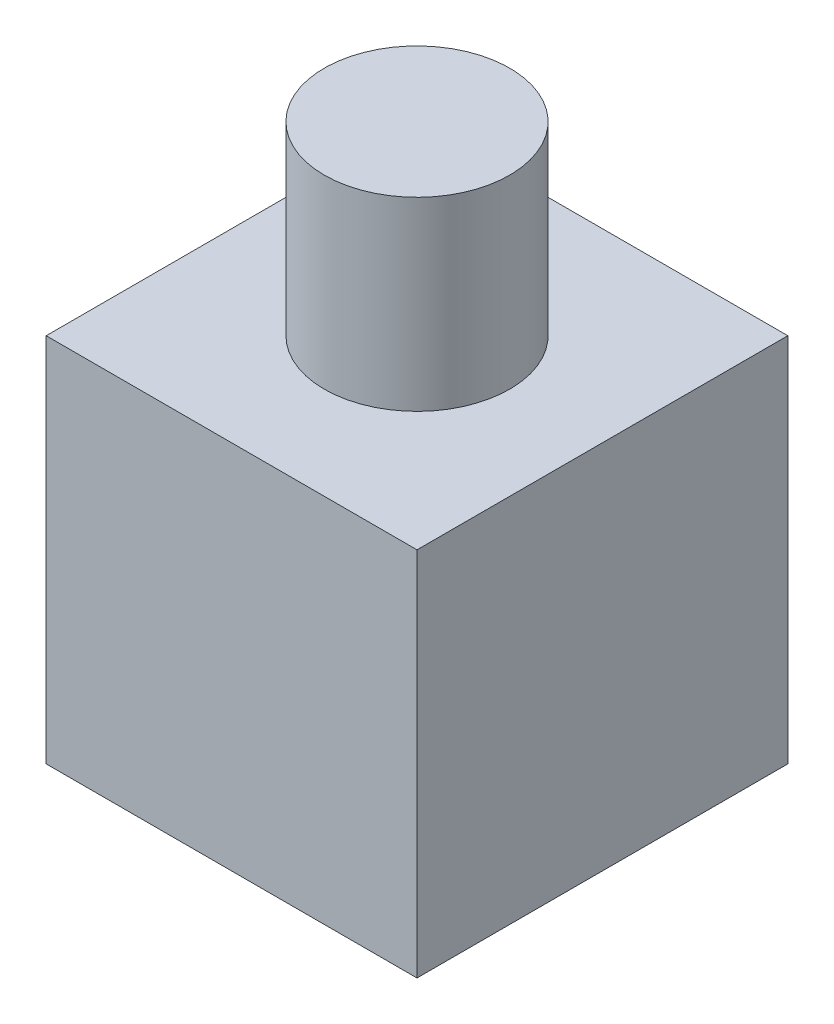
from build123d import *

# Parameters (mm, degrees)
SKETCH1_W           = 254
SKETCH1_H           = 254
BOSS_EXTRUDE1_DEPTH = 254
SKETCH2_R           = 63.5
BOSS_EXTRUDE2_DEPTH = 127


with BuildPart() as part:
    # Sketch1 → Boss-Extrude1 (new body)
    with BuildSketch(Plane(origin=(0, 0, 0), x_dir=(1, 0, 0), z_dir=(0, 1, 0))):
        with Locations((127, 127)):
            Rectangle(SKETCH1_W, SKETCH1_H)
    extrude(amount=BOSS_EXTRUDE1_DEPTH)

    # Sketch2 → Boss-Extrude2 (add)
    with BuildSketch(Plane(origin=(0, 254, 0), x_dir=(1, 0, 0), z_dir=(0, 1, 0))):
        with Locations(Location((127, 127, 0), (0, 0, 270))):
            Circle(SKETCH2_R)
    extrude(amount=BOSS_EXTRUDE2_DEPTH)


solid = part.part
